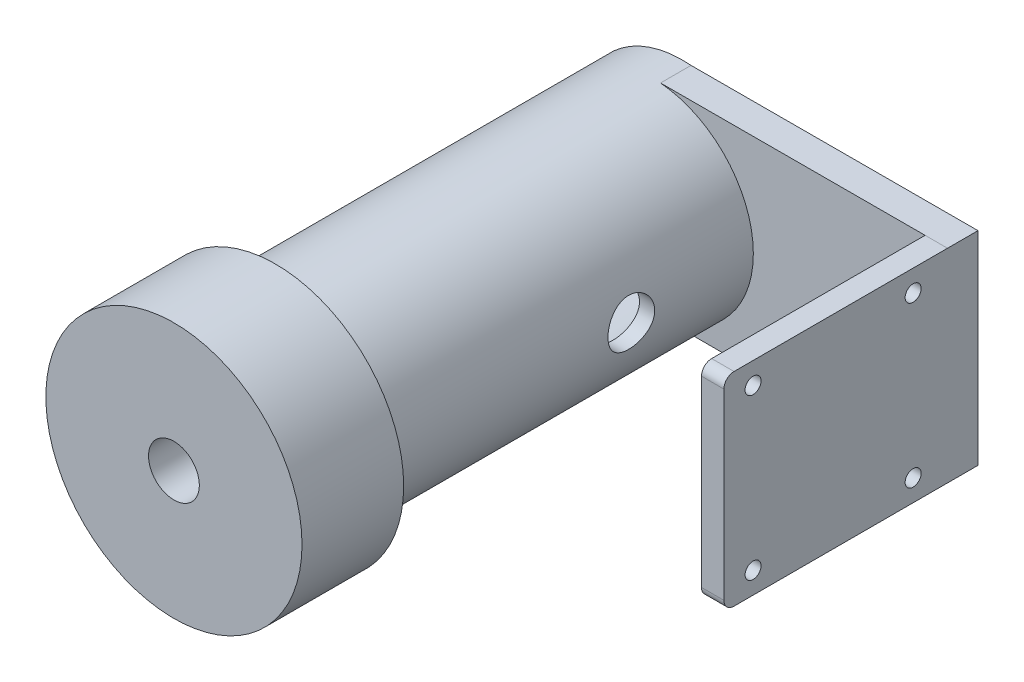
from build123d import *

# Parameters (mm, degrees)
SKETCH3_R               = 16.002
BOSS_EXTRUDE1_DEPTH     = 12.7
SKETCH4_R               = 12.7
SKETCH4_R_2             = 10.795
BOSS_EXTRUDE2_DEPTH     = 50.8
CUT_EXTRUDE1_DEPTH      = 56.612660501
CUT_EXTRUDE1_DEPTH_BACK = 56.612660501
SKETCH9_R               = 2.921
CUT_EXTRUDE2_DEPTH      = 68.412002052
CUT_EXTRUDE2_DEPTH_BACK = 68.412002052
SKETCH10_R              = 3.175
CUT_EXTRUDE3_DEPTH      = 4.191
BOSS_EXTRUDE3_DEPTH     = 3.81
SKETCH13_W              = 2.796188768
SKETCH13_H              = 25.396240454
BOSS_EXTRUDE4_DEPTH     = 27.94
SKETCH14_R              = 1
CUT_EXTRUDE4_DEPTH      = 74.166658198
FILLET1_R               = 1.27


with BuildPart() as part:
    # Sketch3 → Boss-Extrude1 (new body)
    with BuildSketch(Plane.XY):
        Circle(SKETCH3_R)
    extrude(amount=BOSS_EXTRUDE1_DEPTH)

    # Sketch4 → Boss-Extrude2 (add)
    with BuildSketch(Plane(origin=(0, 0, 0), x_dir=(-1, 0, 0), z_dir=(0, 0, -1))):
        with Locations(Location((0, 0, 0), (0, 0, 180))):
            Circle(SKETCH4_R)
        Circle(SKETCH4_R_2, mode=Mode.SUBTRACT)
    extrude(amount=BOSS_EXTRUDE2_DEPTH)

    # Sketch9 → Cut-Extrude1 (cut, two sides: drawn at the far end of the back side and taken through both)
    with BuildSketch(Plane(origin=(0, 0, 0), x_dir=(0, 0, -1), z_dir=(1, 0, 0)).offset(-CUT_EXTRUDE1_DEPTH_BACK)):
        with Locations((31.75, 0)):
            Circle(SKETCH9_R)
    extrude(amount=CUT_EXTRUDE1_DEPTH + CUT_EXTRUDE1_DEPTH_BACK, mode=Mode.SUBTRACT)

    # Sketch10 → Cut-Extrude2 (cut, two sides: drawn at the far end of the back side and taken through both)
    with BuildSketch(Plane.XY.offset(12.7).offset(-CUT_EXTRUDE2_DEPTH_BACK)):
        Circle(SKETCH10_R)
    extrude(amount=CUT_EXTRUDE2_DEPTH + CUT_EXTRUDE2_DEPTH_BACK, mode=Mode.SUBTRACT)

    # Sketch5 → Cut-Extrude3 (cut)
    with BuildSketch(Plane(origin=(0, 0, 0), x_dir=(-1, 0, 0), z_dir=(0, 0, -1))):
        Polygon((0, 6.415804866), (-5.55625, 3.207902433), (-5.55625, -3.207902433), (0, -6.415804866), (5.55625, -3.207902433), (5.55625, 3.207902433), align=None)
    extrude(amount=-CUT_EXTRUDE3_DEPTH, mode=Mode.SUBTRACT)

    # Sketch12 → Boss-Extrude3 (add)
    with BuildSketch(Plane.XY.offset(-46.99)):
        with BuildLine():
            Line((36.960470848, -12.7), (36.960470848, 12.7))
            Line((36.960470848, 12.7), (1.105511904, 12.651792104))
            ThreePointArc((1.105511904, 12.651792104), (9.362958965, 8.580501117), (12.7, 0))
            ThreePointArc((12.7, 0), (9.362958965, -8.580501117), (1.105511904, -12.651792104))
            Line((1.105511904, -12.651792104), (36.960470848, -12.7))
        make_face()
    extrude(amount=-BOSS_EXTRUDE3_DEPTH)

    # Sketch13 → Boss-Extrude4 (add)
    with BuildSketch(Plane.XY.offset(-46.99)):
        with Locations((35.562376464, 0.001879773)):
            Rectangle(SKETCH13_W, SKETCH13_H)
    extrude(amount=BOSS_EXTRUDE4_DEPTH)

    # Sketch14 → Cut-Extrude4 (cut, through all)
    with BuildSketch(Plane.ZY.offset(-34.16428208)):
        with Locations((-22.697395511, 10)):
            Circle(SKETCH14_R)
        with Locations(Location((-42.697395511, 10, 0), (0, 0, 180))):
            Circle(SKETCH14_R)
        with Locations((-42.697395511, -10)):
            Circle(SKETCH14_R)
        with Locations(Location((-22.697395511, -10, 0), (0, 0, 180))):
            Circle(SKETCH14_R)
    extrude(amount=-CUT_EXTRUDE4_DEPTH, mode=Mode.SUBTRACT)

    # Fillet1
    fillet1_edges = [part.edges().sort_by_distance(p)[0] for p in [
        (35.562376464, 12.7, -19.05),
        (35.562376464, -12.696240454, -19.05),
    ]]
    fillet(fillet1_edges, radius=FILLET1_R)


solid = part.part
